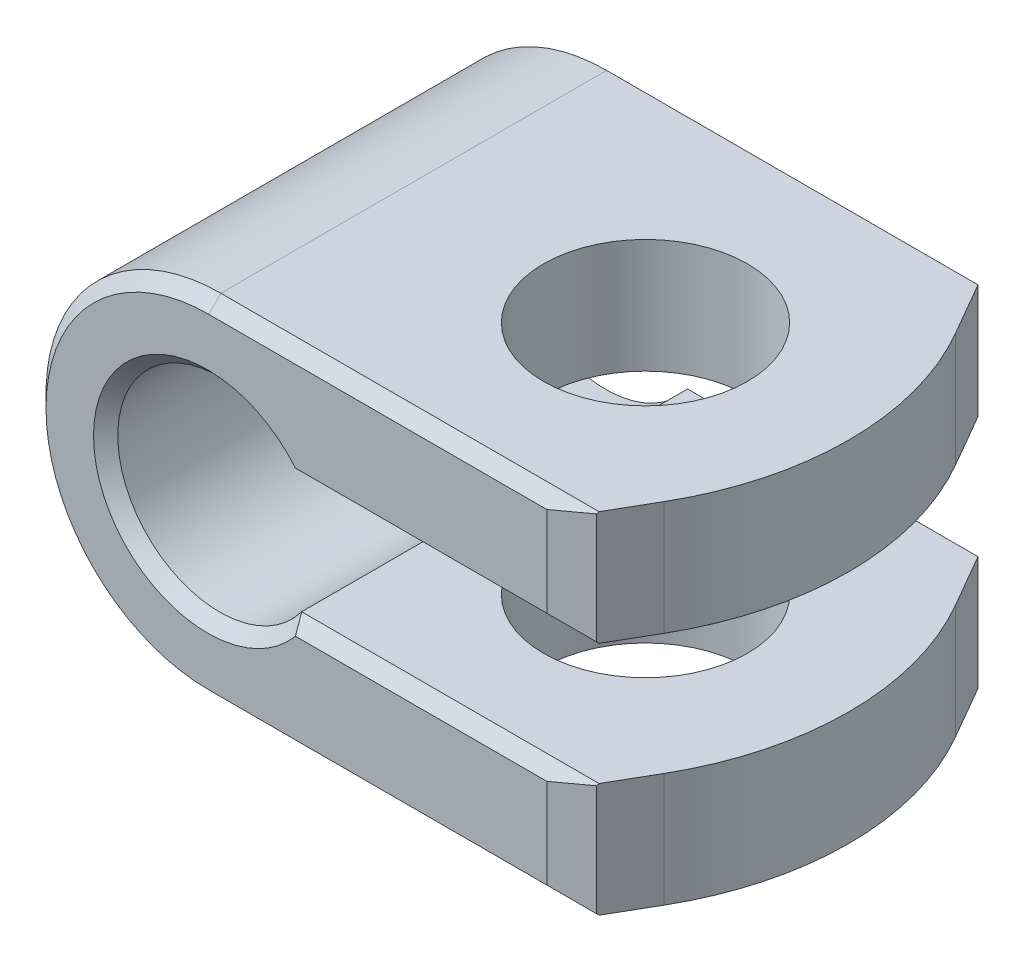
from build123d import *
from OCP.BRepFilletAPI import BRepFilletAPI_MakeChamfer

# Parameters (mm, degrees)
BOSS_EXTRUDE1_DEPTH     = 16.399996177
CUT_EXTRUDE1_DEPTH      = 32.345970628
CUT_EXTRUDE3_DEPTH      = 30.483891782
CUT_EXTRUDE3_DEPTH_BACK = 30.483891782
SKETCH4_R               = 4.2
BOSS_EXTRUDE2_START     = -14.4
BOSS_EXTRUDE2_DEPTH     = 14.4
SKETCH6_W               = 16.399996177
SKETCH6_H               = 5
CUT_EXTRUDE4_DEPTH      = 10
FILLET1_R               = 12
CHAMFER1_SIZE           = 0.5
CHAMFER2_SIZE           = 0.5
CHAMFER2_SIZE2          = 1.366025404


with BuildPart() as part:
    # Sketch1 → Boss-Extrude1 (new body)
    with BuildSketch(Plane.XY.offset(16.399996177)):
        with BuildLine():
            Line((7.2, 0), (22.5, 0))
            Line((22.5, 0), (22.5, 14.4))
            Line((22.5, 14.4), (7.2, 14.4))
            ThreePointArc((7.2, 14.4), (0, 7.2), (7.2, 0))
        make_face()
    extrude(amount=-BOSS_EXTRUDE1_DEPTH)

    # Sketch2 → Cut-Extrude1 (cut, through all)
    with BuildSketch(Plane(origin=(0, 0, 0), x_dir=(-1, 0, 0), z_dir=(0, 0, -1))):
        with BuildLine():
            Line((-22.5, 9.7), (-22.5, 4.7))
            Line((-22.5, 4.7), (-10.532688106, 4.7))
            ThreePointArc((-10.532688106, 4.7), (-2.9577807, 7.2), (-10.532688106, 9.7))
            Line((-10.532688106, 9.7), (-22.5, 9.7))
        make_face()
    extrude(amount=-CUT_EXTRUDE1_DEPTH, mode=Mode.SUBTRACT)

    # Sketch4 → Cut-Extrude3 (cut, two sides: drawn at the far end of the back side and taken through both)
    with BuildSketch(Plane.XZ.offset(-9.7).offset(-CUT_EXTRUDE3_DEPTH_BACK)):
        with Locations((17, 8.2)):
            Circle(SKETCH4_R)
    extrude(amount=CUT_EXTRUDE3_DEPTH + CUT_EXTRUDE3_DEPTH_BACK, mode=Mode.SUBTRACT)

    # Sketch5 → Boss-Extrude2 (add)
    with BuildSketch(Plane(origin=(0, 14.4, 0), x_dir=(1, 0, 0), z_dir=(0, 1, 0)).offset(BOSS_EXTRUDE2_START)):
        Polygon((22.5, 0), (22.5, -16.399996177), (27.234271104, -8.199998088), align=None)
    boss_extrude2 = extrude(amount=BOSS_EXTRUDE2_DEPTH)

    # Mirror3: Boss-Extrude2 across plane
    add(boss_extrude2.mirror(Plane(origin=(0, 7.2, 0), x_dir=(0, 0, 1), z_dir=(0, -1, 0))))

    # Sketch6 → Cut-Extrude4 (cut)
    with BuildSketch(Plane.ZY.offset(-22.5)):
        with Locations((8.199998089, 7.2)):
            Rectangle(SKETCH6_W, SKETCH6_H)
    extrude(amount=-CUT_EXTRUDE4_DEPTH, mode=Mode.SUBTRACT)

    # Fillet1
    fillet1_edges = [part.edges().sort_by_distance(p)[0] for p in [
        (27.234271104, 2.35, 8.199998088),
        (27.234271104, 12.05, 8.199998088),
    ]]
    fillet(fillet1_edges, radius=FILLET1_R)

    # Chamfer1
    chamfer1_edges = [part.edges().sort_by_distance(p)[0] for p in [
        (2.9577807, 7.2, 16.399996177),
    ]]
    chamfer(chamfer1_edges, length=CHAMFER1_SIZE)

    # Chamfer2: one chamfer whose edges measure the first distance from different faces: ONE call of the kernel's chamfer builder (chamfer() names one face for all edges)
    chamfer2_edges_1 = [part.edges().sort_by_distance(p)[0] for p in [
        (22.5, 12.05, 16.399996177),
    ]]
    chamfer2_side_1 = [part.faces().sort_by_distance(p)[0] for p in [
        (23.135084744, 12.05, 15.299997133),
    ]]
    chamfer2_edges_2 = [part.edges().sort_by_distance(p)[0] for p in [
        (22.5, 2.35, 16.399996177),
    ]]
    chamfer2_side_2 = [part.faces().sort_by_distance(p)[0] for p in [
        (23.135084744, 2.35, 15.299997133),
    ]]
    chamfer2_edges_3 = [part.edges().sort_by_distance(p)[0] for p in [
        (14.85, 0, 16.399996177),
        (0, 7.2, 16.399996177),
        (14.85, 14.4, 16.399996177),
        (16.818865224, 9.7, 16.399996177),
        (16.818865224, 4.7, 16.399996177),
    ]]
    chamfer2 = BRepFilletAPI_MakeChamfer(part.part.solid().wrapped)
    for e in chamfer2_edges_1:
        chamfer2.Add(CHAMFER2_SIZE, CHAMFER2_SIZE2, e.wrapped, chamfer2_side_1[0].wrapped)  # the first distance lies on this face
    for e in chamfer2_edges_2:
        chamfer2.Add(CHAMFER2_SIZE, CHAMFER2_SIZE2, e.wrapped, chamfer2_side_2[0].wrapped)  # the first distance lies on this face
    for e in chamfer2_edges_3:
        chamfer2.Add(CHAMFER2_SIZE, e.wrapped)
    add(Compound.cast(chamfer2.Shape()), mode=Mode.REPLACE)


solid = part.part
